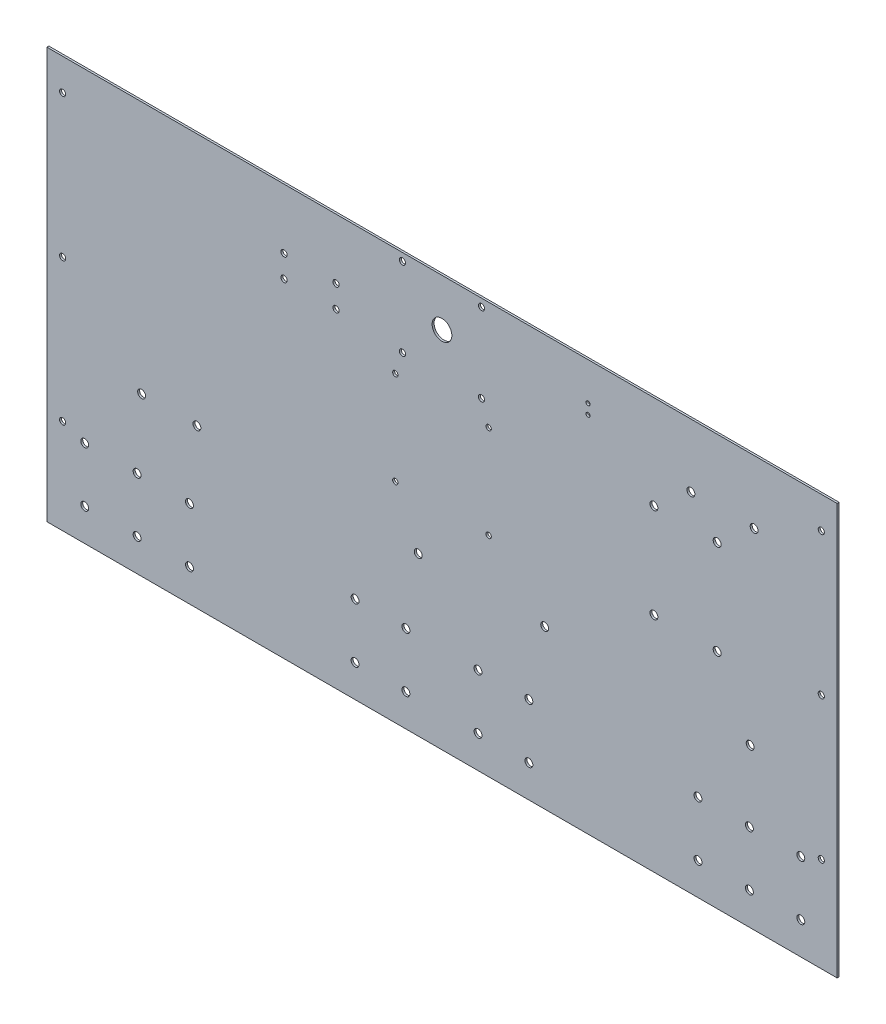
from build123d import *

# Parameters (mm, degrees)
SKETCH3_W                   = 635
SKETCH3_H                   = 330.2
BOSS_EXTRUDE1_DEPTH         = 0.79375
F_10_CLEARANCE_HOLE1_D      = 4.9784
F_3_2_3_2_DIAMETER_HOLE1_D  = 3.2
F_1_4_0_25_DIAMETER_HOLE1_D = 6.35
F_10_CLEARANCE_HOLE2_D      = 4.9784
SKETCH20_R                  = 7.9375
CUT_EXTRUDE1_DEPTH          = 358.864192336
F_8_CLEARANCE_HOLE1_D       = 4.3053
F_1_4_0_25_DIAMETER_HOLE2_D = 6.35


with BuildPart() as part:
    # Sketch3 → Boss-Extrude1 (new, symmetric)
    with BuildSketch(Plane.XY):
        Rectangle(SKETCH3_W, SKETCH3_H)
    extrude(amount=BOSS_EXTRUDE1_DEPTH, both=True)

    # #10 Clearance Hole1 (through all)
    with Locations(Plane.XY.offset(0.79375)):
        with Locations((-304.8, 139.7), (-304.8, 25.4), (-304.8, -88.9), (304.735940926, 139.7), (304.735940926, 25.4), (304.735940926, -88.9)):
            Hole(F_10_CLEARANCE_HOLE1_D / 2)

    # Ø3.2 (3.2) Diameter Hole1 (through all)
    with Locations(Plane.XY.offset(0.79375)):
        with Locations((117.288403864, 134.7), (117.288403864, 126.7)):
            Hole(F_3_2_3_2_DIAMETER_HOLE1_D / 2)

    # 1/4 (0.25) Diameter Hole1 (through all)
    with Locations(Plane.XY.offset(0.79375)):
        with Locations((-287.085687485, -95.167589121), (-287.085687485, -139.167589121), (-202.884383934, -95.167589121), (-202.884383934, -139.167589121), (-69.85, -95.167589121), (-69.85, -139.167589121), (-29, -139.167589121), (-29, -95.167589121), (28.940403864, -95.167589121), (28.940403864, -139.167589121), (69.790403864, -139.167589121), (69.790403864, -95.167589121), (205.651059519, -95.167589121), (205.651059519, -139.167589121), (288.284715889, -95.167589121), (288.284715889, -139.167589121), (-244.985035709, -95.167589121), (-244.985035709, -139.167589121), (246.967887704, -95.167589121), (246.967887704, -139.167589121)):
            Hole(F_1_4_0_25_DIAMETER_HOLE1_D / 2)

    # #10 Clearance Hole2 (through all)
    with Locations(Plane(origin=(0, 0, -0.79375), x_dir=(-1, 0, 0), z_dir=(0, 0, -1))):
        with Locations((-31.720201932, 158.886686509), (-31.720201932, 95.386686509), (31.779798068, 95.386686509), (31.779798068, 158.886686509), (85.127947172, 98.931351753), (85.127947172, 116.903670564), (126.921175422, 99.123670564), (126.921175422, 116.903670564)):
            Hole(F_10_CLEARANCE_HOLE2_D / 2)

    # Sketch20 → Cut-Extrude1 (cut, through all)
    with BuildSketch(Plane.XY.offset(0.79375)):
        with Locations((-0.029798068, 127.136686509)):
            Circle(SKETCH20_R)
    extrude(amount=-CUT_EXTRUDE1_DEPTH, mode=Mode.SUBTRACT)

    # #8 Clearance Hole1 (through all)
    with Locations(Plane(origin=(0, 0, -0.79375), x_dir=(-1, 0, 0), z_dir=(0, 0, -1))):
        with Locations((37.529798068, 77.888640884), (-37.470201932, 77.888640884), (-37.470201932, 2.888640884), (37.529798068, 2.888640884)):
            Hole(F_8_CLEARANCE_HOLE1_D / 2)

    # 1/4 (0.25) Diameter Hole2 (through all)
    with Locations(Plane(origin=(0, 0, -0.79375), x_dir=(-1, 0, 0), z_dir=(0, 0, -1))):
        with Locations((-221.051314498, 89.77655242), (-170.251314498, 89.77655242), (-221.051314498, 13.92655242), (-170.251314498, 13.92655242), (-250.765403863, 114.3), (-199.965403863, 114.3), (-247.590403863, -38.1), (-82.490403863, -38.1), (19.109596137, -38.1), (196.909596137, -38.1), (241.359596137, -38.1)):
            Hole(F_1_4_0_25_DIAMETER_HOLE2_D / 2)


solid = part.part
